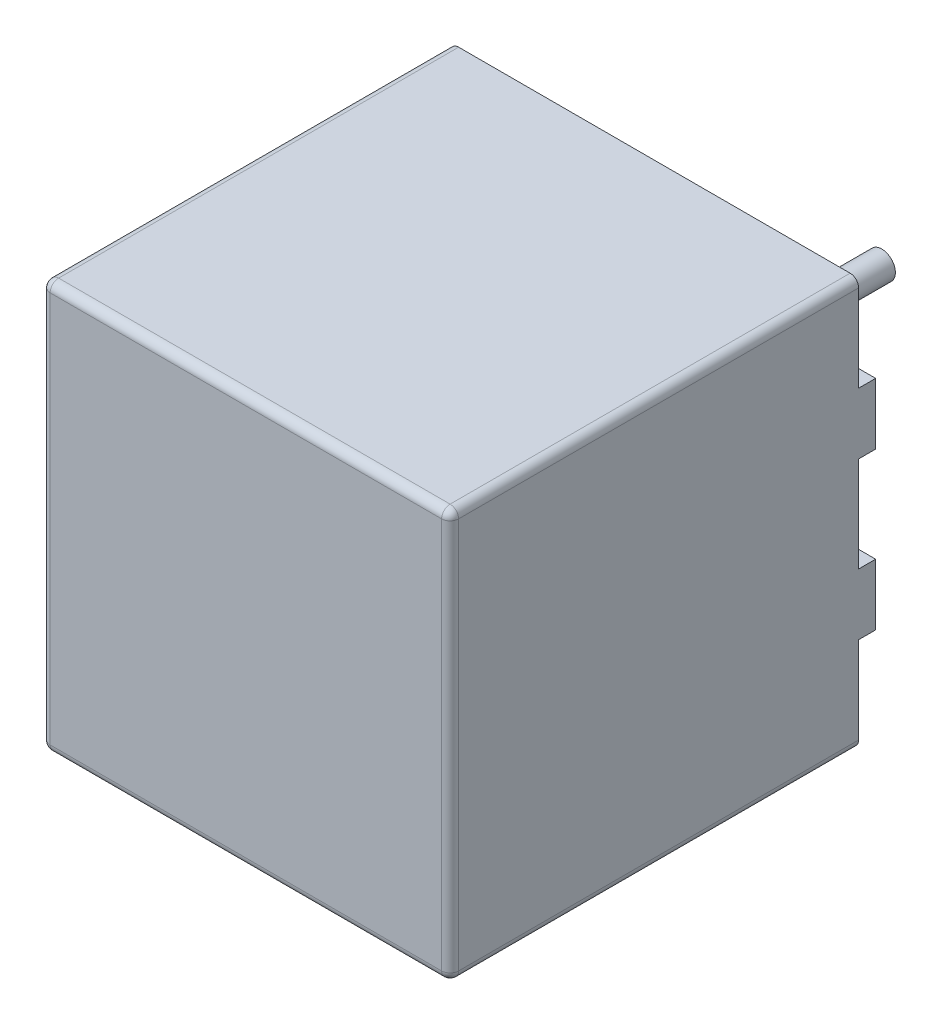
from build123d import *

# Parameters (mm, degrees)
BOSS_EXTRUDE1_DEPTH = 12.5
CUT_EXTRUDE1_DEPTH  = 1
SKETCH3_W           = 0.5
SKETCH3_H           = 2.8
CUT_EXTRUDE2_DEPTH  = 20
FILLET1_R           = 0.25
FILLET2_R           = 0.25
SKETCH4_R           = 0.4
BOSS_EXTRUDE2_DEPTH = 2.1


with BuildPart() as part:
    # Sketch1 → Boss-Extrude1 (new body)
    with BuildSketch(Plane.XY):
        with BuildLine():
            Line((-5.75, 6), (5.75, 6))
            ThreePointArc((5.75, 6), (5.926776695, 5.926776695), (6, 5.75))
            Line((6, 5.75), (6, -5.75))
            ThreePointArc((6, -5.75), (5.926776695, -5.926776695), (5.75, -6))
            Line((5.75, -6), (-5.75, -6))
            ThreePointArc((-5.75, -6), (-5.926776695, -5.926776695), (-6, -5.75))
            Line((-6, -5.75), (-6, 5.75))
            ThreePointArc((-6, 5.75), (-5.926776695, 5.926776695), (-5.75, 6))
        make_face()
    extrude(amount=BOSS_EXTRUDE1_DEPTH)

    # Sketch2 → Cut-Extrude1 (cut)
    with BuildSketch(Plane(origin=(0, 0, 0), x_dir=(-1, 0, 0), z_dir=(0, 0, -1))):
        with BuildLine():
            Line((5.25, -5.5), (-5.25, -5.5))
            ThreePointArc((-5.25, -5.5), (-5.426776695, -5.426776695), (-5.5, -5.25))
            Line((-5.5, -5.25), (-5.5, 5.25))
            ThreePointArc((-5.5, 5.25), (-5.426776695, 5.426776695), (-5.25, 5.5))
            Line((-5.25, 5.5), (5.25, 5.5))
            ThreePointArc((5.25, 5.5), (5.426776695, 5.426776695), (5.5, 5.25))
            Line((5.5, 5.25), (5.5, -5.25))
            ThreePointArc((5.5, -5.25), (5.426776695, -5.426776695), (5.25, -5.5))
        make_face()
    extrude(amount=-CUT_EXTRUDE1_DEPTH, mode=Mode.SUBTRACT)

    # Sketch3 → Cut-Extrude2 (cut)
    with BuildSketch(Plane(origin=(6, 0, 0), x_dir=(0, 0, -1), z_dir=(1, 0, 0))):
        with Locations((-0.25, 0)):
            Rectangle(SKETCH3_W, SKETCH3_H)
        with Locations((-0.25, 4.6)):
            Rectangle(SKETCH3_W, SKETCH3_H)
        with Locations((-0.25, -4.6)):
            Rectangle(SKETCH3_W, SKETCH3_H)
    extrude(amount=-CUT_EXTRUDE2_DEPTH, mode=Mode.SUBTRACT)

    # Fillet1
    fillet1_edges = [part.edges().sort_by_distance(p)[0] for p in [
        (-5.426776695, -5.426776695, 1),
        (0, -5.5, 1),
        (5.426776695, -5.426776695, 1),
        (5.5, 0, 1),
        (5.426776695, 5.426776695, 1),
        (0, 5.5, 1),
        (-5.426776695, 5.426776695, 1),
        (-5.5, 0, 1),
    ]]
    fillet(fillet1_edges, radius=FILLET1_R)

    # Fillet2
    fillet2_edges = [part.edges().sort_by_distance(p)[0] for p in [
        (5.926776695, -5.926776695, 12.5),
        (6, 0, 12.5),
        (5.926776695, 5.926776695, 12.5),
        (0, 6, 12.5),
        (-5.926776695, 5.926776695, 12.5),
        (-6, 0, 12.5),
        (-5.926776695, -5.926776695, 12.5),
        (0, -6, 12.5),
    ]]
    fillet(fillet2_edges, radius=FILLET2_R)

    # Sketch4 → Boss-Extrude2 (add)
    with BuildSketch(Plane(origin=(0, 0, 1), x_dir=(-1, 0, 0), z_dir=(0, 0, -1))):
        with Locations(Location((-5.08, 5.08, 0), (0, 0, 154.849335249))):
            Circle(SKETCH4_R)
        with Locations(Location((5.08, -5.08, 0), (0, 0, 205.150663413))):
            Circle(SKETCH4_R)
    extrude(amount=BOSS_EXTRUDE2_DEPTH)


solid = part.part
